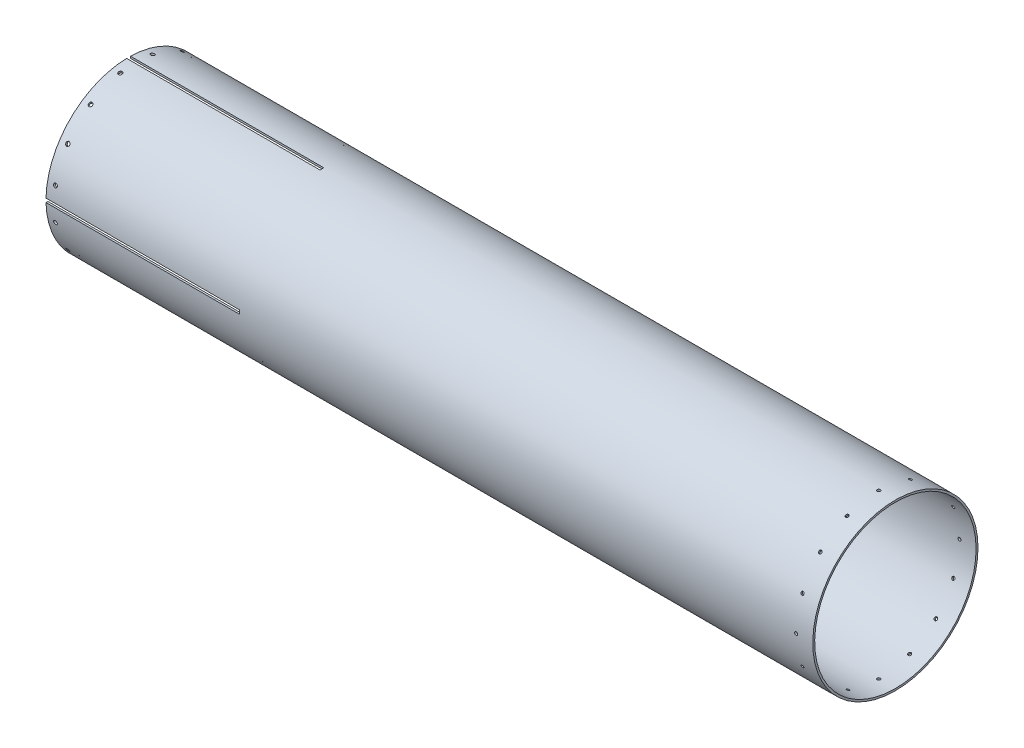
from build123d import *

# Parameters (mm, degrees)
SZKIC1_R                    = 87
SZKIC1_R_2                  = 85
DODANIE_WYCI_GNI_CIE1_DEPTH = 807.51
WYTNIJ_WYCI_GNI_CIE1_DEPTH  = 203.6
SZKIC4_R                    = 2
WYTNIJ_WYCI_GNI_CIE2_DEPTH  = 61.6
SZYK_KO_OWY1_COUNT          = 16
SZKIC6_R                    = 1.6
WYTNIJ_WYCI_GNI_CIE3_DEPTH  = 61.6
SZYK_KO_OWY3_COUNT          = 16


with BuildPart() as part:
    # Szkic1 → Dodanie-wyciągnięcie1 (new body)
    with BuildSketch(Plane(origin=(0, 0, 0), x_dir=(0, 0, -1), z_dir=(1, 0, 0))):
        Circle(SZKIC1_R)
        Circle(SZKIC1_R_2, mode=Mode.SUBTRACT)
    extrude(amount=DODANIE_WYCI_GNI_CIE1_DEPTH)

    # Szkic2 → Wytnij-wyciągnięcie1 (cut)
    with BuildSketch(Plane(origin=(0, 0, 0), x_dir=(0, 0, -1), z_dir=(1, 0, 0))):
        with BuildLine():
            Line((-86.977008456, -2), (-2, -2))
            Line((-2, -2), (-2, -86.977008456))
            ThreePointArc((-2, -86.977008456), (0, -87), (2, -86.977008456))
            Line((2, -86.977008456), (2, -2))
            Line((2, -2), (86.977008456, -2))
            ThreePointArc((86.977008456, -2), (87, 0), (86.977008456, 2))
            Line((86.977008456, 2), (2, 2))
            Line((2, 2), (2, 86.977008456))
            ThreePointArc((2, 86.977008456), (0, 87), (-2, 86.977008456))
            Line((-2, 86.977008456), (-2, 2))
            Line((-2, 2), (-86.977008456, 2))
            ThreePointArc((-86.977008456, 2), (-87, 0), (-86.977008456, -2))
        make_face()
    extrude(amount=WYTNIJ_WYCI_GNI_CIE1_DEPTH, mode=Mode.SUBTRACT)

    # Szkic4 → Wytnij-wyciągnięcie2 (cut)
    with BuildSketch(Plane(origin=(0, 85.328319395, 16.972858015), x_dir=(1, 0, 0), z_dir=(0, 0.9807852804032319, 0.19509032201612145))):
        with Locations(Location((8.35, 0, 0), (0, 0, 270))):
            Circle(SZKIC4_R)
    wytnij_wyci_gni_cie2 = extrude(amount=-WYTNIJ_WYCI_GNI_CIE2_DEPTH, mode=Mode.SUBTRACT)

    # Szyk kołowy1: Wytnij-wyciągnięcie2 ×16 about axis
    szyk_ko_owy1_axis = Axis((807.51, 0, 0), (-1, 0, 0))
    for i in range(1, SZYK_KO_OWY1_COUNT):
        add(wytnij_wyci_gni_cie2.rotate(szyk_ko_owy1_axis, i * 360 / SZYK_KO_OWY1_COUNT), mode=Mode.SUBTRACT)

    # Szkic6 → Wytnij-wyciągnięcie3 (cut)
    with BuildSketch(Plane(origin=(0, 87, 0), x_dir=(1, 0, 0), z_dir=(0, 1, 0))):
        with Locations(Location((790.01, 0, 0), (0, 0, 270))):
            Circle(SZKIC6_R)
    wytnij_wyci_gni_cie3 = extrude(amount=-WYTNIJ_WYCI_GNI_CIE3_DEPTH, mode=Mode.SUBTRACT)

    # Szyk kołowy3: Wytnij-wyciągnięcie3 ×16 about axis
    szyk_ko_owy3_axis = Axis((807.51, 0, 0), (-1, 0, 0))
    for i in range(1, SZYK_KO_OWY3_COUNT):
        add(wytnij_wyci_gni_cie3.rotate(szyk_ko_owy3_axis, i * 360 / SZYK_KO_OWY3_COUNT), mode=Mode.SUBTRACT)


solid = part.part
